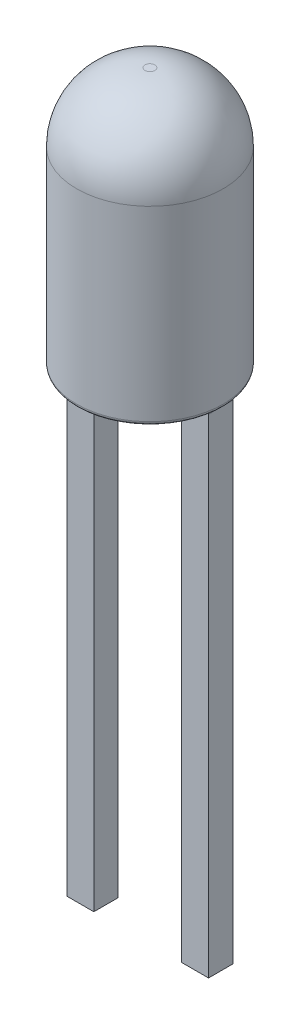
from build123d import *

# Parameters (mm, degrees)
SKETCH2_R                  = 1.5
BOSS_EXTRUDE1_DEPTH        = 5.3
FILLET1_R                  = 1.4
BOSS_EXTRUDE2_DEPTH        = 0.25
BOSS_EXTRUDE2_DEPTH_BACK   = 0.25
BOSS_EXTRUDE2_2_DEPTH      = 0.25
BOSS_EXTRUDE2_2_DEPTH_BACK = 0.25
SKETCH4_W                  = 0.55
SKETCH4_H                  = 0.5
BOSS_EXTRUDE3_DEPTH        = 10
BOSS_EXTRUDE3_2_DEPTH      = 10
FILLET2_R                  = 0.05
FILLET3_R                  = 0.08


with BuildPart() as part:
    # Sketch2 → Boss-Extrude1 (new body)
    with BuildSketch(Plane(origin=(0, 0, 0), x_dir=(1, 0, 0), z_dir=(0, 1, 0))):
        with Locations(Location((0, 0, 0), (0, 0, 270))):
            Circle(SKETCH2_R)
    extrude(amount=BOSS_EXTRUDE1_DEPTH)

    # Fillet1
    fillet1_edges = [part.edges().sort_by_distance(p)[0] for p in [
        (0, 5.3, -1.5),
    ]]
    fillet(fillet1_edges, radius=FILLET1_R)

    # Fillet3
    fillet3_edges = [part.edges().sort_by_distance(p)[0] for p in [
        (0, 0, -1.5),
    ]]
    fillet(fillet3_edges, radius=FILLET3_R)


with BuildPart() as body_2:
    # Sketch3 → Boss-Extrude2 (new, two sides: drawn at the far end of the back side and taken through both)
    with BuildSketch(Plane.XY.offset(-BOSS_EXTRUDE2_DEPTH_BACK)):
        Polygon((-1.45, 2.6), (-1.45, 0), (-0.9, 0), (-0.9, 0.6), (-0.624114196, 0.6), (-0.624114196, 0.82503781), (-1.225355096, 2.6), align=None)
    extrude(amount=BOSS_EXTRUDE2_DEPTH + BOSS_EXTRUDE2_DEPTH_BACK)


with BuildPart() as body_3:
    # Sketch3 → Boss-Extrude2 2 (new, two sides: drawn at the far end of the back side and taken through both)
    with BuildSketch(Plane.XY.offset(-BOSS_EXTRUDE2_2_DEPTH_BACK)):
        Polygon((1.45, 2.6), (-0.872452828, 2.6), (0.496677266, 0.6), (0.9, 0.6), (0.9, 0), (1.45, 0), align=None)
    extrude(amount=BOSS_EXTRUDE2_2_DEPTH + BOSS_EXTRUDE2_2_DEPTH_BACK)

    # Sketch5 → Cut-Revolve1 (revolve, cut)
    with BuildSketch(Plane(origin=(0, 0, 0), x_dir=(0, 0, -1), z_dir=(1, 0, 0))):
        Polygon((0, 2.6), (0, 2.3), (-0.6, 2.6), align=None)
    revolve(axis=Axis((0, 2.6, 0), (0, -1, 0)), mode=Mode.SUBTRACT)


with BuildPart() as body_4:
    # Sketch4 → Boss-Extrude3 (new body)
    with BuildSketch(Plane(origin=(0, 0, 0), x_dir=(-1, 0, 0), z_dir=(0, -1, 0))):
        with Locations((1.175, 0)):
            Rectangle(SKETCH4_W, SKETCH4_H)
    extrude(amount=BOSS_EXTRUDE3_DEPTH)


with BuildPart() as body_5:
    # Sketch4 → Boss-Extrude3 2 (new body)
    with BuildSketch(Plane(origin=(0, 0, 0), x_dir=(-1, 0, 0), z_dir=(0, -1, 0))):
        with Locations((-1.175, 0)):
            Rectangle(SKETCH4_W, SKETCH4_H)
    extrude(amount=BOSS_EXTRUDE3_2_DEPTH)


with BuildPart() as body_6:
    # Sketch5<3> → Revolve1 (revolve)
    with BuildSketch(Plane(origin=(0, 0, 0), x_dir=(0, 0, -1), z_dir=(1, 0, 0))):
        Polygon((0, 2.6), (0, 2.3), (-0.6, 2.6), align=None)
    revolve(axis=Axis((0, 2.6, 0), (0, -1, 0)))

    # Fillet2
    fillet2_edges = [body_6.edges().sort_by_distance(p)[0] for p in [
        (0, 2.6, -0.6),
    ]]
    fillet(fillet2_edges, radius=FILLET2_R)


solid = Compound([part.part, body_2.part, body_3.part, body_4.part, body_5.part, body_6.part])
